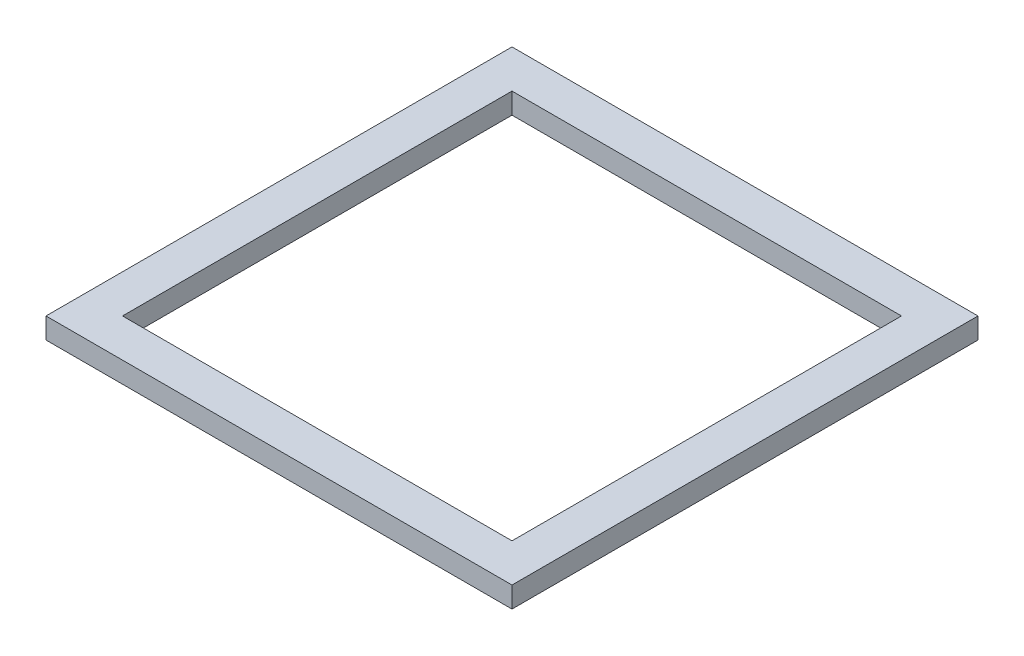
from build123d import *

# Parameters (mm, degrees)
SKETCH1_W           = 425.45
SKETCH1_H           = 425.45
SKETCH1_W_2         = 355.6
SKETCH1_H_2         = 355.6
BOSS_EXTRUDE1_DEPTH = 19.05


with BuildPart() as part:
    # Sketch1 → Boss-Extrude1 (new body)
    with BuildSketch(Plane(origin=(0, 0, 0), x_dir=(1, 0, 0), z_dir=(0, 1, 0))):
        with Locations((-22.279469933, -537.483715485)):
            Rectangle(SKETCH1_W, SKETCH1_H)
        with Locations((-22.279469933, -537.483715485)):
            Rectangle(SKETCH1_W_2, SKETCH1_H_2, mode=Mode.SUBTRACT)
    extrude(amount=BOSS_EXTRUDE1_DEPTH)


solid = part.part
